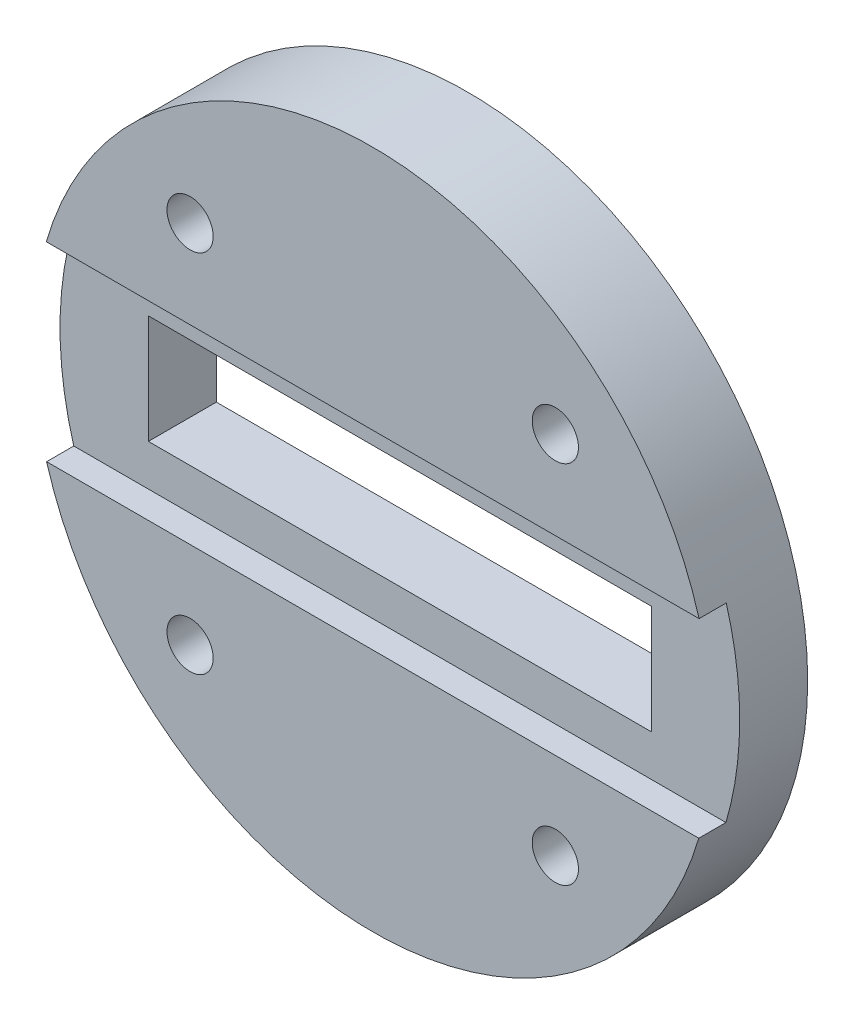
from build123d import *

# Parameters (mm, degrees)
BOSS_EXTRU_1_DEPTH           = 0.1
BOSS_EXTRU_1_DEPTH_BACK      = 6.9
ESQUISSE1_R                  = 25
ESQUISSE1_R_2                = 1.7
ESQUISSE2_W                  = 37
ESQUISSE2_H                  = 8
ENL_V_MAT_EXTRU_1_DEPTH      = 37.041642582
ENL_V_MAT_EXTRU_3_DEPTH      = 51.801015595
ENL_V_MAT_EXTRU_3_DEPTH_BACK = 51.801015595
ESQUISSE3_W                  = 2.84
ESQUISSE3_H                  = 14


with BuildPart() as part:
    # Esquisse1 → Boss.-Extru.1 (new, two sides: drawn at the far end of the back side and taken through both)
    with BuildSketch(Plane.XY.offset(-BOSS_EXTRU_1_DEPTH_BACK)):
        Circle(ESQUISSE1_R)
        with Locations((-13.435028843, 13.435028843)):
            Circle(ESQUISSE1_R_2, mode=Mode.SUBTRACT)
        with Locations((13.435028843, 13.435028843)):
            Circle(ESQUISSE1_R_2, mode=Mode.SUBTRACT)
        with Locations((13.435028843, -13.435028843)):
            Circle(ESQUISSE1_R_2, mode=Mode.SUBTRACT)
        with Locations((-13.435028843, -13.435028843)):
            Circle(ESQUISSE1_R_2, mode=Mode.SUBTRACT)
    extrude(amount=BOSS_EXTRU_1_DEPTH + BOSS_EXTRU_1_DEPTH_BACK)

    # Esquisse2 → Enlèv. mat.-Extru.1 (cut, through all)
    with BuildSketch(Plane.XY.offset(0.1)):
        Rectangle(ESQUISSE2_W, ESQUISSE2_H)
    extrude(amount=-ENL_V_MAT_EXTRU_1_DEPTH, mode=Mode.SUBTRACT)

    # Esquisse3 → Enlèv. mat.-Extru.3 (cut, two sides: drawn at the far end of the back side and taken through both)
    with BuildSketch(Plane(origin=(18.5, 0, 1.068261133), x_dir=(0, 0, 1), z_dir=(-1, 0, 0)).offset(-ENL_V_MAT_EXTRU_3_DEPTH_BACK)):
        with Locations((-1.545739837, -0.037482161)):
            Rectangle(ESQUISSE3_W, ESQUISSE3_H)
    extrude(amount=ENL_V_MAT_EXTRU_3_DEPTH + ENL_V_MAT_EXTRU_3_DEPTH_BACK, mode=Mode.SUBTRACT)


solid = part.part
